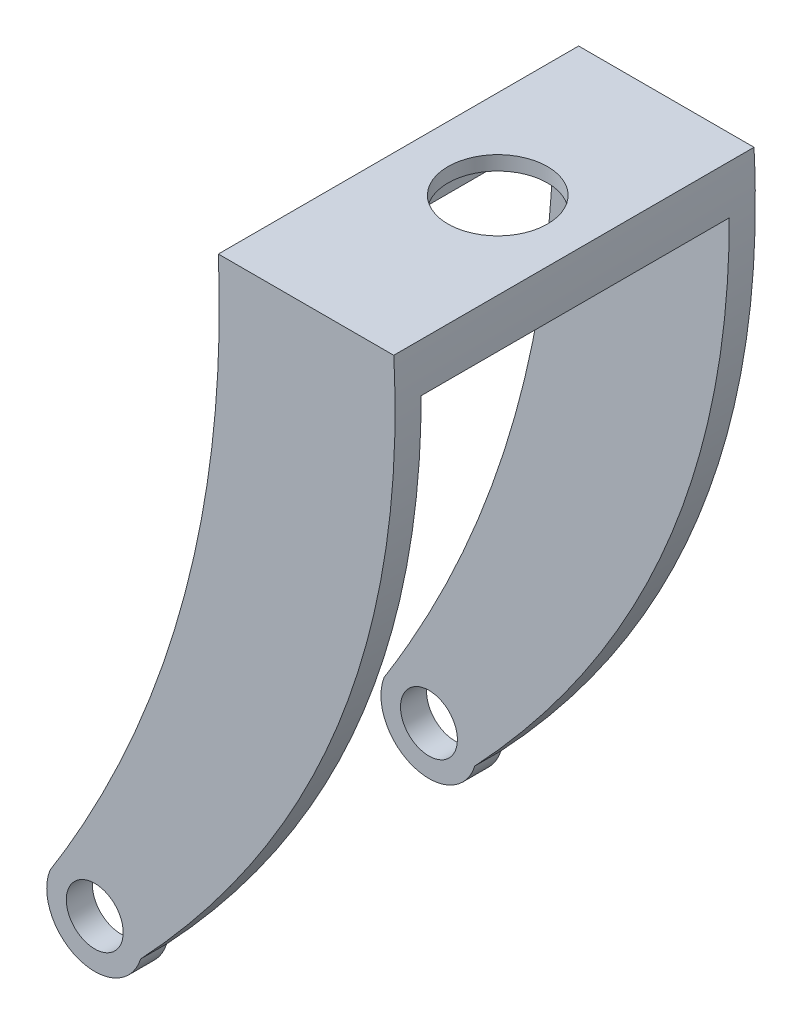
from build123d import *

# Parameters (mm, degrees)
CROQUIS1_R                 = 6
SALIENTE_EXTRUIR1_DEPTH    = 76
CORTAR_EXTRUIR1_DEPTH      = 53
CORTAR_EXTRUIR1_DEPTH_BACK = 83
CROQUIS2_W                 = 65
CROQUIS2_H                 = 134.125
CORTAR_EXTRUIR4_DEPTH      = 7
CROQUIS6_R                 = 10.5
CORTAR_EXTRUIR5_DEPTH      = 7


with BuildPart() as part:
    # Croquis1 → Saliente-Extruir1 (new body)
    with BuildSketch(Plane.XY):
        with BuildLine():
            Line((3.623560213, 29.985380117), (40.623560213, 29.985380117))
            add(Edge.make_bspline(
                [(40.623560213, 29.985380117), (44.757987914, -45.934087744), (-12.775954516, -106.998983358)],
                knots=[0, 0, 0, 1, 1, 1], degree=2))
            ThreePointArc((-12.775954516, -106.998983358), (-25.787263181, -113.574217266), (-31.882365072, -100.331196951))
            add(Edge.make_bspline(
                [(3.623560213, 29.985380117), (6.510357156, -38.808737065), (-31.882365072, -100.331196951)],
                knots=[0, 0, 0, 1, 1, 1], degree=2))
        make_face()
        with Locations((-22.451139251, -104.014619883)):
            Circle(CROQUIS1_R, mode=Mode.SUBTRACT)
    extrude(amount=SALIENTE_EXTRUIR1_DEPTH)

    # Croquis2 → Cortar-Extruir1 (cut, two sides: drawn at the far end of the back side and taken through both)
    with BuildSketch(Plane(origin=(0, 0, 0), x_dir=(0, 0, -1), z_dir=(1, 0, 0)).offset(-CORTAR_EXTRUIR1_DEPTH_BACK)):
        with Locations((-38, -47.077119883)):
            Rectangle(CROQUIS2_W, CROQUIS2_H)
    extrude(amount=CORTAR_EXTRUIR1_DEPTH + CORTAR_EXTRUIR1_DEPTH_BACK, mode=Mode.SUBTRACT)

    # Croquis5 → Cortar-Extruir4 (cut)
    with BuildSketch(Plane.XZ.offset(-19.985380117)):
        with BuildLine():
            Line((10.825063576, 63.739022161), (33.900709288, 63.739022161))
            ThreePointArc((33.900709288, 63.739022161), (36.729136412, 62.567449286), (37.900709288, 59.739022161))
            Line((37.900709288, 59.739022161), (37.900709288, 11.860366898))
            ThreePointArc((37.900709288, 11.860366898), (36.729136412, 9.031939774), (33.900709288, 7.860366898))
            Line((33.900709288, 7.860366898), (10.825063576, 7.860366898))
            ThreePointArc((10.825063576, 7.860366898), (7.996636452, 9.031939774), (6.825063576, 11.860366898))
            Line((6.825063576, 11.860366898), (6.825063576, 59.739022161))
            ThreePointArc((6.825063576, 59.739022161), (7.996636452, 62.567449286), (10.825063576, 63.739022161))
        make_face()
    extrude(amount=-CORTAR_EXTRUIR4_DEPTH, mode=Mode.SUBTRACT)

    # Croquis6 → Cortar-Extruir5 (cut)
    with BuildSketch(Plane(origin=(0, 26.985380117, 0), x_dir=(-1, 0, 0), z_dir=(0, -1, 0))):
        with Locations(Location((-22.362886432, -35.79969453, 0), (0, 0, 90))):
            Circle(CROQUIS6_R)
    extrude(amount=-CORTAR_EXTRUIR5_DEPTH, mode=Mode.SUBTRACT)


solid = part.part
